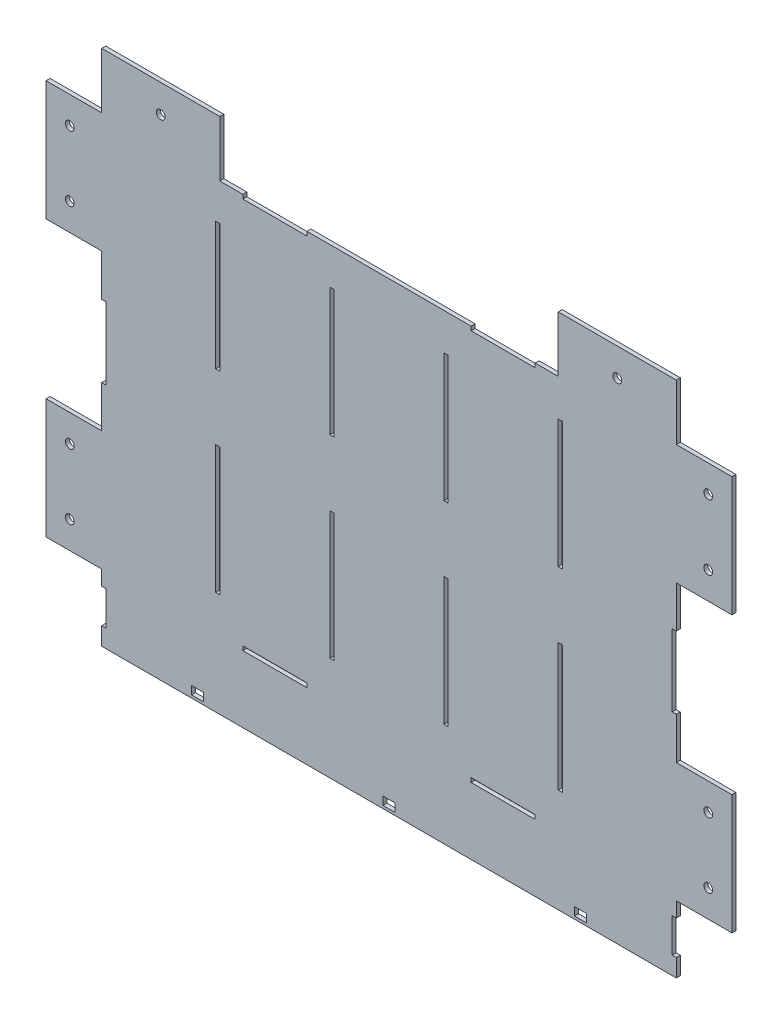
from build123d import *

# Parameters (mm, degrees)
SKETCH1_W            = 457.223
SKETCH1_H            = 367.60800004
BOSS_EXTRUDE2_DEPTH  = 3.175
SKETCH8_W            = 44.275
SKETCH8_H            = 95.25
SKETCH8_W_2          = 93.98
SKETCH8_H_2          = 44.45
BOSS_EXTRUDE3_DEPTH  = 3.175
M6_CLEARANCE_HOLE1_D = 7
SKETCH12_W           = 3.184
SKETCH12_H           = 57.15
SKETCH12_W_2         = 3.175
SKETCH12_H_2         = 26.9875
SKETCH12_W_3         = 50.9524
SKETCH12_H_3         = 3.3274
SKETCH12_W_4         = 50.8
SKETCH12_H_4         = 3.175
SKETCH12_W_5         = 3.179
CUT_EXTRUDE3_DEPTH   = 345.589489363
SKETCH14_W           = 3.3274
SKETCH14_H           = 101.7524
SKETCH14_W_2         = 3.175
SKETCH14_H_2         = 101.6
CUT_EXTRUDE4_DEPTH   = 345.589489363
LPATTERN2_COUNT      = 4
LPATTERN2_PITCH      = 90.806999996
SKETCH16_W           = 9.6774
SKETCH16_H           = 6.5024
SKETCH16_W_2         = 9.525
SKETCH16_H_2         = 6.35
CUT_EXTRUDE5_DEPTH   = 345.589489363


with BuildPart() as part:
    # Sketch1 → Boss-Extrude2 (new body)
    with BuildSketch(Plane.XY):
        with Locations((0, -26.588)):
            Rectangle(SKETCH1_W, SKETCH1_H)
    extrude(amount=BOSS_EXTRUDE2_DEPTH)

    # Sketch8 → Boss-Extrude3 (add)
    with BuildSketch(Plane(origin=(0, 0, 0), x_dir=(-1, 0, 0), z_dir=(0, 0, -1))):
        with Locations((-250.749, 109.59100002)):
            Rectangle(SKETCH8_W, SKETCH8_H)
        with Locations((-181.6215, 179.44100002)):
            Rectangle(SKETCH8_W_2, SKETCH8_H_2)
        with Locations((-250.749, -109.59100002)):
            Rectangle(SKETCH8_W, SKETCH8_H)
    boss_extrude3 = extrude(amount=-BOSS_EXTRUDE3_DEPTH)

    # Mirror7: Boss-Extrude3 across plane
    add(boss_extrude3.mirror(Plane(origin=(0, 0, 0), x_dir=(0, 0, 1), z_dir=(1, 0, 0))))

    # M6 Clearance Hole1 (through all)
    with Locations(Plane(origin=(0, 0, 0), x_dir=(-1, 0, 0), z_dir=(0, 0, -1))):
        with Locations((-254.0115, -135.59100002), (-254.0115, -83.59100002), (-254.0115, 83.59100002), (-254.0115, 135.59100002), (-181.6215, 179.44100002)):
            m6_clearance_hole1 = Hole(M6_CLEARANCE_HOLE1_D / 2)

    # Mirror8: M6 Clearance Hole1 across plane
    add(m6_clearance_hole1.mirror(Plane(origin=(0, 0, 0), x_dir=(0, 0, 1), z_dir=(1, 0, 0))), mode=Mode.SUBTRACT)

    # Sketch12 → Cut-Extrude3 (cut, through all)
    # profile 1 of 16: a face of its own
    with BuildSketch(Plane(origin=(0, 0, 0), x_dir=(-1, 0, 0), z_dir=(0, 0, -1))):
        with Locations((-227.0195, 0)):
            Rectangle(SKETCH12_W, SKETCH12_H)
    # profile 2 of 16: a face of its own
    with BuildSketch(Plane(origin=(0, 0, 0), x_dir=(-1, 0, 0), z_dir=(0, 0, -1))):
        Polygon((-228.6115, 28.6512), (-228.6115, 28.575), (-225.4275, 28.575), (-225.4275, -28.575), (-228.6115, -28.575), (-228.6115, -28.6512), (-225.3513, -28.6512), (-225.3513, 28.6512), align=None)
    # profile 3 of 16: a face of its own
    with BuildSketch(Plane(origin=(0, 0, 0), x_dir=(-1, 0, 0), z_dir=(0, 0, -1))):
        with Locations((-227.024, -182.66100002)):
            Rectangle(SKETCH12_W_2, SKETCH12_H_2)
    # profile 4 of 16: a face of its own
    with BuildSketch(Plane(origin=(0, 0, 0), x_dir=(-1, 0, 0), z_dir=(0, 0, -1))):
        Polygon((-228.6115, -196.15475002), (-228.6115, -196.23095002), (-225.3603, -196.23095002), (-225.3603, -169.09105002), (-228.6115, -169.09105002), (-228.6115, -169.16725002), (-225.4365, -169.16725002), (-225.4365, -196.15475002), align=None)
    # profile 5 of 16: a face of its own
    with BuildSketch(Plane(origin=(0, 0, 0), x_dir=(-1, 0, 0), z_dir=(0, 0, -1))):
        with Locations((-90.8045, -155.62850002)):
            Rectangle(SKETCH12_W_3, SKETCH12_H_3)
        with Locations((-90.8045, -155.62850002)):
            Rectangle(SKETCH12_W_4, SKETCH12_H_4, mode=Mode.SUBTRACT)
    # profile 6 of 16: a face of its own
    with BuildSketch(Plane(origin=(0, 0, 0), x_dir=(-1, 0, 0), z_dir=(0, 0, -1))):
        with Locations((-90.8045, -155.62850002)):
            Rectangle(SKETCH12_W_4, SKETCH12_H_4)
    # profile 7 of 16: a face of its own
    with BuildSketch(Plane(origin=(0, 0, 0), x_dir=(-1, 0, 0), z_dir=(0, 0, -1))):
        with Locations((90.8095, -155.62850002)):
            Rectangle(SKETCH12_W_3, SKETCH12_H_3)
        with Locations((90.8095, -155.62850002)):
            Rectangle(SKETCH12_W_4, SKETCH12_H_4, mode=Mode.SUBTRACT)
    # profile 8 of 16: a face of its own
    with BuildSketch(Plane(origin=(0, 0, 0), x_dir=(-1, 0, 0), z_dir=(0, 0, -1))):
        with Locations((90.8095, -155.62850002)):
            Rectangle(SKETCH12_W_4, SKETCH12_H_4)
    # profile 9 of 16: a face of its own
    with BuildSketch(Plane(origin=(0, 0, 0), x_dir=(-1, 0, 0), z_dir=(0, 0, -1))):
        with Locations((227.024, -182.66100002)):
            Rectangle(SKETCH12_W_2, SKETCH12_H_2)
    # profile 10 of 16: a face of its own
    with BuildSketch(Plane(origin=(0, 0, 0), x_dir=(-1, 0, 0), z_dir=(0, 0, -1))):
        Polygon((225.3603, -196.23095002), (228.6115, -196.23095002), (228.6115, -196.15475002), (225.4365, -196.15475002), (225.4365, -169.16725002), (228.6115, -169.16725002), (228.6115, -169.09105002), (225.3603, -169.09105002), align=None)
    # profile 11 of 16: a face of its own
    with BuildSketch(Plane(origin=(0, 0, 0), x_dir=(-1, 0, 0), z_dir=(0, 0, -1))):
        with Locations((227.022, 0)):
            Rectangle(SKETCH12_W_5, SKETCH12_H)
    # profile 12 of 16: a face of its own
    with BuildSketch(Plane(origin=(0, 0, 0), x_dir=(-1, 0, 0), z_dir=(0, 0, -1))):
        Polygon((225.4325, -28.575), (225.4325, 28.575), (228.6115, 28.575), (228.6115, 28.6512), (225.3563, 28.6512), (225.3563, -28.6512), (228.6115, -28.6512), (228.6115, -28.575), align=None)
    # profile 13 of 16: a face of its own
    with BuildSketch(Plane(origin=(0, 0, 0), x_dir=(-1, 0, 0), z_dir=(0, 0, -1))):
        with Locations((90.8095, 155.62850002)):
            Rectangle(SKETCH12_W_4, SKETCH12_H_4)
    # profile 14 of 16: a face of its own
    with BuildSketch(Plane(origin=(0, 0, 0), x_dir=(-1, 0, 0), z_dir=(0, 0, -1))):
        Polygon((65.4095, 157.21600002), (65.3333, 157.21600002), (65.3333, 153.96480002), (116.2857, 153.96480002), (116.2857, 157.21600002), (116.2095, 157.21600002), (116.2095, 154.04100002), (65.4095, 154.04100002), align=None)
    # profile 15 of 16: a face of its own
    with BuildSketch(Plane(origin=(0, 0, 0), x_dir=(-1, 0, 0), z_dir=(0, 0, -1))):
        with Locations((-90.8045, 155.62850002)):
            Rectangle(SKETCH12_W_4, SKETCH12_H_4)
    # profile 16 of 16: a face of its own
    with BuildSketch(Plane(origin=(0, 0, 0), x_dir=(-1, 0, 0), z_dir=(0, 0, -1))):
        Polygon((-116.2045, 154.04100002), (-116.2045, 157.21600002), (-116.2807, 157.21600002), (-116.2807, 153.96480002), (-65.3283, 153.96480002), (-65.3283, 157.21600002), (-65.4045, 157.21600002), (-65.4045, 154.04100002), align=None)
    extrude(amount=-CUT_EXTRUDE3_DEPTH, mode=Mode.SUBTRACT)

    # Sketch14 → Cut-Extrude4 (cut, through all)
    # profile 1 of 4: a face of its own
    with BuildSketch(Plane(origin=(0, 0, 0), x_dir=(-1, 0, 0), z_dir=(0, 0, -1))):
        with Locations((-136.208, 77.02050001)):
            Rectangle(SKETCH14_W, SKETCH14_H)
        with Locations((-136.208, 77.02050001)):
            Rectangle(SKETCH14_W_2, SKETCH14_H_2, mode=Mode.SUBTRACT)
    # profile 2 of 4: a face of its own
    with BuildSketch(Plane(origin=(0, 0, 0), x_dir=(-1, 0, 0), z_dir=(0, 0, -1))):
        with Locations((-136.208, 77.02050001)):
            Rectangle(SKETCH14_W_2, SKETCH14_H_2)
    # profile 3 of 4: a face of its own
    with BuildSketch(Plane(origin=(0, 0, 0), x_dir=(-1, 0, 0), z_dir=(0, 0, -1))):
        with Locations((-136.208, -77.02050001)):
            Rectangle(SKETCH14_W, SKETCH14_H)
        with Locations((-136.208, -77.02050001)):
            Rectangle(SKETCH14_W_2, SKETCH14_H_2, mode=Mode.SUBTRACT)
    # profile 4 of 4: a face of its own
    with BuildSketch(Plane(origin=(0, 0, 0), x_dir=(-1, 0, 0), z_dir=(0, 0, -1))):
        with Locations((-136.208, -77.02050001)):
            Rectangle(SKETCH14_W_2, SKETCH14_H_2)
    cut_extrude4 = extrude(amount=-CUT_EXTRUDE4_DEPTH, mode=Mode.SUBTRACT)

    # LPattern2: Cut-Extrude4 ×4
    with Locations(*[(-i * LPATTERN2_PITCH, 0, 0) for i in range(1, LPATTERN2_COUNT)]):
        add(cut_extrude4, mode=Mode.SUBTRACT)

    # Sketch16 → Cut-Extrude5 (cut, through all)
    # profile 1 of 6: a face of its own
    with BuildSketch(Plane.XY.offset(3.175)):
        with Locations((152.4, -204.92974)):
            Rectangle(SKETCH16_W, SKETCH16_H)
        with Locations((152.4, -204.92974)):
            Rectangle(SKETCH16_W_2, SKETCH16_H_2, mode=Mode.SUBTRACT)
    # profile 2 of 6: a face of its own
    with BuildSketch(Plane.XY.offset(3.175)):
        with Locations((152.4, -204.92974)):
            Rectangle(SKETCH16_W_2, SKETCH16_H_2)
    # profile 3 of 6: a face of its own
    with BuildSketch(Plane.XY.offset(3.175)):
        with Locations((0, -204.92974)):
            Rectangle(SKETCH16_W, SKETCH16_H)
        with Locations((0, -204.92974)):
            Rectangle(SKETCH16_W_2, SKETCH16_H_2, mode=Mode.SUBTRACT)
    # profile 4 of 6: a face of its own
    with BuildSketch(Plane.XY.offset(3.175)):
        with Locations((0, -204.92974)):
            Rectangle(SKETCH16_W_2, SKETCH16_H_2)
    # profile 5 of 6: a face of its own
    with BuildSketch(Plane.XY.offset(3.175)):
        with Locations((-152.4, -204.92974)):
            Rectangle(SKETCH16_W, SKETCH16_H)
        with Locations((-152.4, -204.92974)):
            Rectangle(SKETCH16_W_2, SKETCH16_H_2, mode=Mode.SUBTRACT)
    # profile 6 of 6: a face of its own
    with BuildSketch(Plane.XY.offset(3.175)):
        with Locations((-152.4, -204.92974)):
            Rectangle(SKETCH16_W_2, SKETCH16_H_2)
    extrude(amount=-CUT_EXTRUDE5_DEPTH, mode=Mode.SUBTRACT)


solid = part.part
